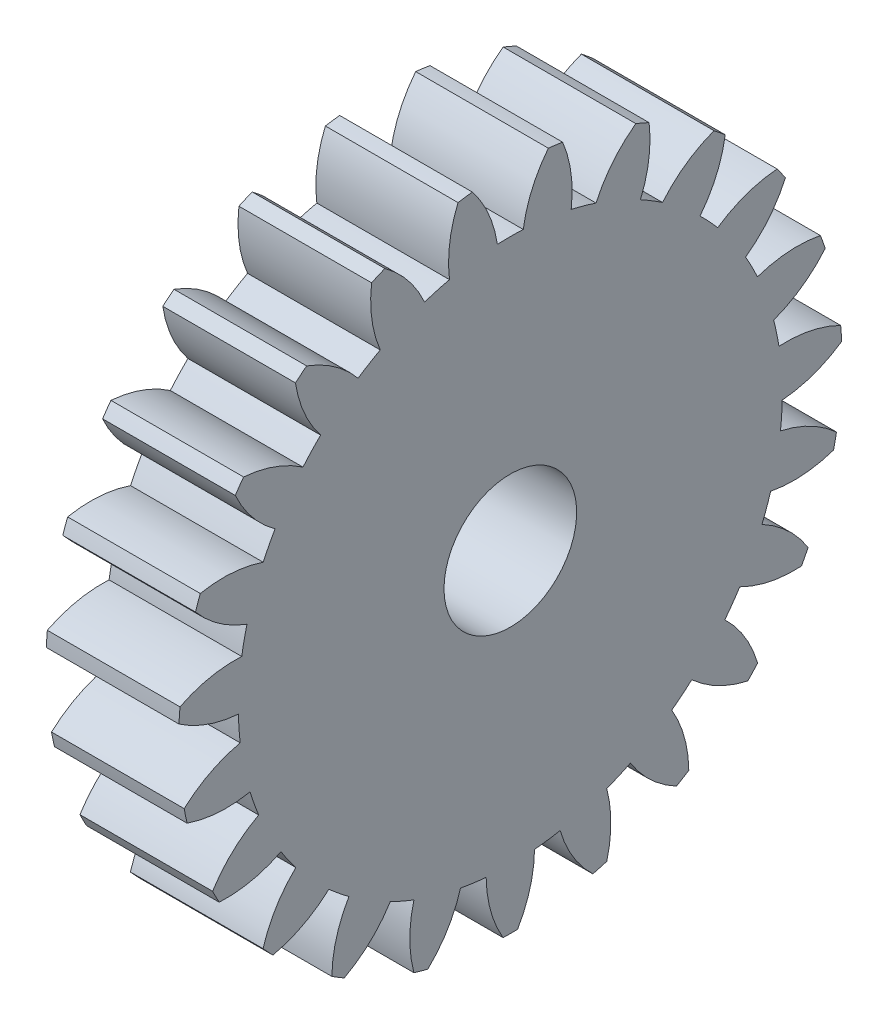
from build123d import *

# Parameters (mm, degrees)
BASPROSKE_W     = 5
BASPROSKE_H     = 12.5
TOOTHCUT_DEPTH  = 19.371173071
TEETHCUTS_COUNT = 23
TEETHCUTS_ANGLE = 344.347826087
BORSKE_R        = 2.5
BORE_DEPTH      = 50.0000508


with BuildPart() as part:
    # BasProSke → Base-Revolve (revolve)
    with BuildSketch(Plane(origin=(0, 0, 0), x_dir=(1, 0, 0), z_dir=(0, 1, 0)), mode=Mode.PRIVATE) as base_revolve_sk:
        with Locations((2.5, 6.25)):
            Rectangle(BASPROSKE_W, BASPROSKE_H)
    revolve(base_revolve_sk.sketch.rotate(Axis((-10, 0, 0), (1, 0, 0)), 180), axis=Axis((-10, 0, 0), (1, 0, 0)))

    # TooCutSke → ToothCut (cut, through all)
    with BuildSketch(Plane(origin=(0, 0, 0), x_dir=(0, 0, -1), z_dir=(1, 0, 0))):
        with BuildLine():
            ThreePointArc((0.487075069, 10.237419542), (0, 10.249), (-0.487075069, 10.237419542))
            ThreePointArc((-0.487075069, 10.237419542), (-0.822200209, 11.403353821), (-1.450473694, 12.441132232))
            ThreePointArc((-1.450473694, 12.441132232), (0, 12.5254), (1.450473694, 12.441132232))
            ThreePointArc((1.450473694, 12.441132232), (0.822200209, 11.403353821), (0.487075069, 10.237419542))
        make_face()
    toothcut = extrude(amount=TOOTHCUT_DEPTH, mode=Mode.SUBTRACT)

    # TeethCuts: ToothCut ×23 about axis
    teethcuts_axis = Axis((-10, 0, 0), (1, 0, 0))
    for i in range(1, TEETHCUTS_COUNT):
        add(toothcut.rotate(teethcuts_axis, i * TEETHCUTS_ANGLE / (TEETHCUTS_COUNT - 1)), mode=Mode.SUBTRACT)

    # BorSke → Bore (cut, symmetric)
    with BuildSketch(Plane(origin=(0, 0, 0), x_dir=(0, 0, -1), z_dir=(1, 0, 0))):
        with Locations(Location((0, 0, 0), (0, 0, 180))):
            Circle(BORSKE_R)
    extrude(amount=BORE_DEPTH, both=True, mode=Mode.SUBTRACT)


solid = part.part
